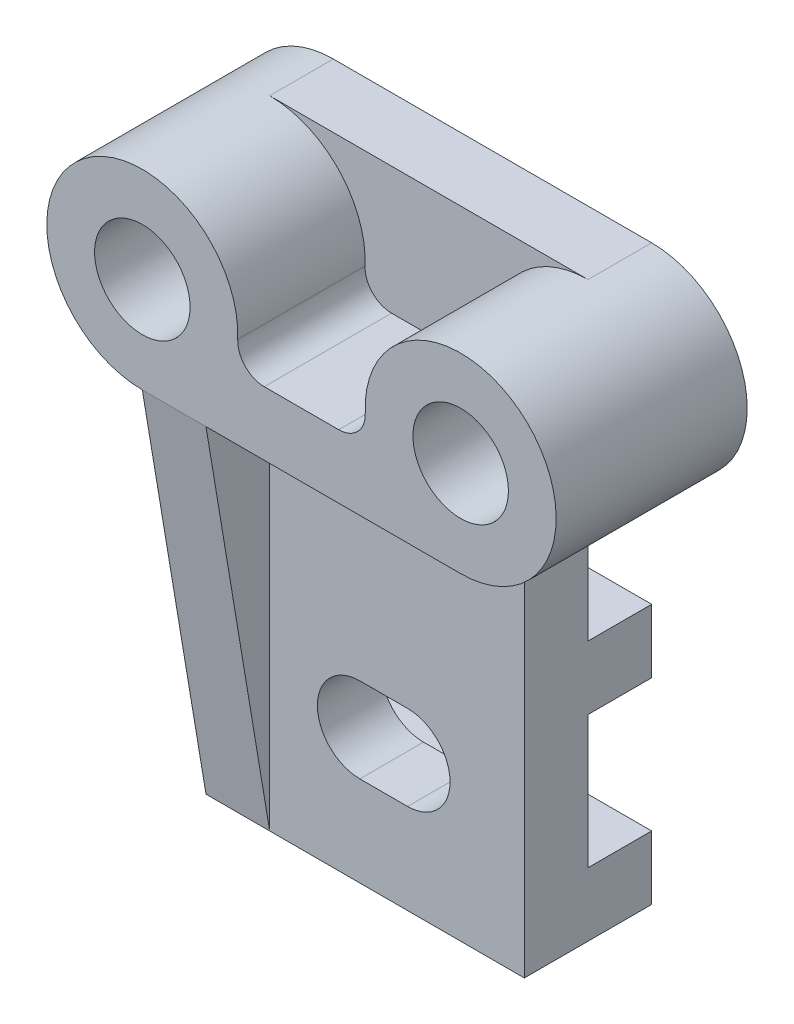
from build123d import *

# Parameters (mm, degrees)
SKETCH1_R           = 9
BOSS_EXTRUDE1_DEPTH = 36
BOSS_EXTRUDE2_DEPTH = 12
SKETCH1_6_W         = 72
SKETCH1_6_H         = 60
BOSS_EXTRUDE4_DEPTH = 24
SKETCH1_8_W         = 23
SKETCH1_8_H         = 60
SKETCH1_8_W_2       = 25
CUT_EXTRUDE2_DEPTH  = 12
BOSS_EXTRUDE5_START = 24
SKETCH1_10_W        = 72
SKETCH1_10_H        = 12
BOSS_EXTRUDE5_DEPTH = 12
CUT_EXTRUDE3_DEPTH  = 12
FILLET1_R           = 5


with BuildPart() as part:
    # Sketch1 → Boss-Extrude1 (new body)
    with BuildSketch(Plane(origin=(0, 0, 0), x_dir=(0, 1, 0), z_dir=(0, 0, 1))):
        with BuildLine():
            Line((39, -13.029437252), (39, 13.029437252))
            ThreePointArc((39, 13.029437252), (59.696938457, 40.392304845), (27, 30))
            Line((27, 30), (27, -30))
            ThreePointArc((27, -30), (59.696938457, -40.392304845), (39, -13.029437252))
        make_face()
        with Locations((45, 30)):
            Circle(SKETCH1_R, mode=Mode.SUBTRACT)
        with Locations((45, -30)):
            Circle(SKETCH1_R, mode=Mode.SUBTRACT)
    extrude(amount=BOSS_EXTRUDE1_DEPTH)

    # Sketch1<4> → Boss-Extrude2 (add)
    with BuildSketch(Plane(origin=(0, 0, 0), x_dir=(0, 1, 0), z_dir=(0, 0, 1))):
        with BuildLine():
            Line((63, -30), (63, 30))
            ThreePointArc((63, 30), (55.392304845, 15.303061543), (39, 13.029437252))
            Line((39, 13.029437252), (39, -13.029437252))
            ThreePointArc((39, -13.029437252), (55.392304845, -15.303061543), (63, -30))
        make_face()
    extrude(amount=BOSS_EXTRUDE2_DEPTH)

    # Sketch1<6> → Boss-Extrude4 (add)
    with BuildSketch(Plane(origin=(0, 0, 0), x_dir=(0, 1, 0), z_dir=(0, 0, 1))):
        with Locations((-9, 0)):
            Rectangle(SKETCH1_6_W, SKETCH1_6_H)
        with BuildLine():
            ThreePointArc((-28, 1), (-20, 9), (-12, 1))
            Line((-12, 1), (-12, -8))
            ThreePointArc((-12, -8), (-20, -16), (-28, -8))
            Line((-28, -8), (-28, 1))
        make_face(mode=Mode.SUBTRACT)
    extrude(amount=BOSS_EXTRUDE4_DEPTH)

    # Sketch1<8> → Cut-Extrude2 (cut)
    # profile 1 of 2: a face of its own
    with BuildSketch(Plane(origin=(0, 0, 0), x_dir=(0, 1, 0), z_dir=(0, 0, 1))):
        with Locations((15.5, 0)):
            Rectangle(SKETCH1_8_W, SKETCH1_8_H)
    # profile 2 of 2: a face of its own
    with BuildSketch(Plane(origin=(0, 0, 0), x_dir=(0, 1, 0), z_dir=(0, 0, 1))):
        with Locations((-20.5, 0)):
            Rectangle(SKETCH1_8_W_2, SKETCH1_8_H)
        with BuildLine():
            ThreePointArc((-28, 1), (-20, 9), (-12, 1))
            Line((-12, 1), (-12, -8))
            ThreePointArc((-12, -8), (-20, -16), (-28, -8))
            Line((-28, -8), (-28, 1))
        make_face(mode=Mode.SUBTRACT)
    extrude(amount=CUT_EXTRUDE2_DEPTH, mode=Mode.SUBTRACT)

    # Sketch1<10> → Boss-Extrude5 (add)
    with BuildSketch(Plane(origin=(0, 0, 0), x_dir=(0, 1, 0), z_dir=(0, 0, 1)).offset(BOSS_EXTRUDE5_START)):
        with Locations((-9, 24)):
            Rectangle(SKETCH1_10_W, SKETCH1_10_H)
    extrude(amount=BOSS_EXTRUDE5_DEPTH)

    # Sketch2 → Cut-Extrude3 (cut)
    with BuildSketch(Plane.YZ.offset(-18)):
        Polygon((-45, 36), (-45, 24), (27, 36), align=None)
    extrude(amount=-CUT_EXTRUDE3_DEPTH, mode=Mode.SUBTRACT)

    # Fillet1
    fillet1_edges = [part.edges().sort_by_distance(p)[0] for p in [
        (-13.029437252, 39, 24),
        (13.029437252, 39, 24),
    ]]
    fillet(fillet1_edges, radius=FILLET1_R)


solid = part.part
